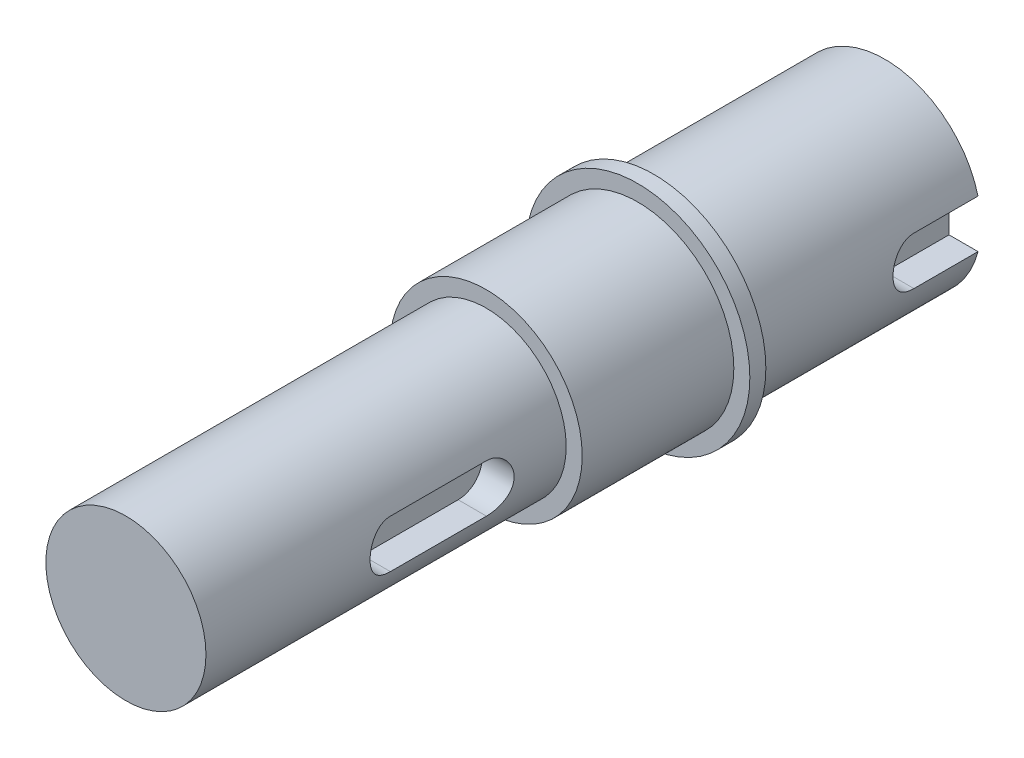
from build123d import *

# Parameters (mm, degrees)
SKETCH_1_R          = 5
EXTRUDE_1_DEPTH     = 15.5
SKETCH_2_R          = 6
EXTRUDE_2_DEPTH     = 17.91
CUT_EXTRUDE_1_DEPTH = 2
SKETCH_4_R          = 5
EXTRUDE_3_DEPTH     = 7
SKETCH_5_R          = 7
EXTRUDE_4_DEPTH     = 1
SKETCH_6_R          = 6
EXTRUDE_5_DEPTH     = 6
CUT_EXTRUDE_2_DEPTH = 2
SKETCH_8_R          = 1.25
CUT_EXTRUDE_3_DEPTH = 10
EXTRUDE_START       = 1
SKETCH_9_R          = 7
EXTRUDE_6_DEPTH     = 1
CUT_EXTRUDE_START   = -1
SKETCH_10_R         = 7
SKETCH_10_R_2       = 6
CUT_EXTRUDE_5_DEPTH = 1


with BuildPart() as part:
    # 草图1 → 凸台-拉伸1 (new body)
    with BuildSketch(Plane.XY):
        Circle(SKETCH_1_R)
    extrude(amount=EXTRUDE_1_DEPTH)

    # 草图2 → 凸台-拉伸2 (add)
    with BuildSketch(Plane(origin=(0, 0, 0), x_dir=(-1, 0, 0), z_dir=(0, 0, -1))):
        Circle(SKETCH_2_R)
    extrude(amount=EXTRUDE_2_DEPTH)

    # 草图3 → 切除-拉伸1 (cut)
    with BuildSketch(Plane(origin=(5, 0, 0), x_dir=(0, 0, -1), z_dir=(1, 0, 0))):
        with BuildLine():
            Line((-10.75, 1.5), (-4.75, 1.5))
            ThreePointArc((-4.75, 1.5), (-3.25, 0), (-4.75, -1.5))
            Line((-4.75, -1.5), (-10.75, -1.5))
            ThreePointArc((-10.75, -1.5), (-12.25, 0), (-10.75, 1.5))
        make_face()
    extrude(amount=-CUT_EXTRUDE_1_DEPTH, mode=Mode.SUBTRACT)

    # 草图4 → 凸台-拉伸3 (add)
    with BuildSketch(Plane.XY.offset(15.5)):
        Circle(SKETCH_4_R)
    extrude(amount=EXTRUDE_3_DEPTH)

    # 草图5 → 凸台-拉伸4 (add)
    with BuildSketch(Plane(origin=(0, 0, -17.91), x_dir=(-1, 0, 0), z_dir=(0, 0, -1))):
        Circle(SKETCH_5_R)
    extrude(amount=EXTRUDE_4_DEPTH)

    # 草图6 → 凸台-拉伸5 (add)
    with BuildSketch(Plane(origin=(0, 0, -18.91), x_dir=(-1, 0, 0), z_dir=(0, 0, -1))):
        Circle(SKETCH_6_R)
    extrude(amount=EXTRUDE_5_DEPTH)

    # 草图7 → 切除-拉伸2 (cut)
    with BuildSketch(Plane(origin=(6, 0, 0), x_dir=(0, 0, -1), z_dir=(1, 0, 0))):
        with BuildLine():
            Line((20.91, 1.5), (24.91, 1.5))
            ThreePointArc((24.91, 1.5), (26.41, 0), (24.91, -1.5))
            Line((24.91, -1.5), (20.91, -1.5))
            ThreePointArc((20.91, -1.5), (19.41, 0), (20.91, 1.5))
        make_face()
    extrude(amount=-CUT_EXTRUDE_2_DEPTH, mode=Mode.SUBTRACT)

    # 草图8 → 切除-拉伸3 (cut)
    with BuildSketch(Plane(origin=(0, 0, -24.91), x_dir=(-1, 0, 0), z_dir=(0, 0, -1))):
        Circle(SKETCH_8_R)
    extrude(amount=-CUT_EXTRUDE_3_DEPTH, mode=Mode.SUBTRACT)

    # 草图9 → 凸台-拉伸6 (add)
    with BuildSketch(Plane.XY.offset(-10.47).offset(EXTRUDE_START)):
        with Locations(Location((0, 0, 0), (0, 0, 180))):
            Circle(SKETCH_9_R)
    extrude(amount=-EXTRUDE_6_DEPTH)

    # 草图10 → 切除-拉伸5 (cut)
    with BuildSketch(Plane(origin=(0, 0, -18.91), x_dir=(-1, 0, 0), z_dir=(0, 0, -1)).offset(CUT_EXTRUDE_START)):
        with Locations(Location((0, 0, 0), (0, 0, 180))):
            Circle(SKETCH_10_R)
        with Locations(Location((0, 0, 0), (0, 0, 180))):
            Circle(SKETCH_10_R_2, mode=Mode.SUBTRACT)
    extrude(amount=CUT_EXTRUDE_5_DEPTH, mode=Mode.SUBTRACT)


solid = part.part
